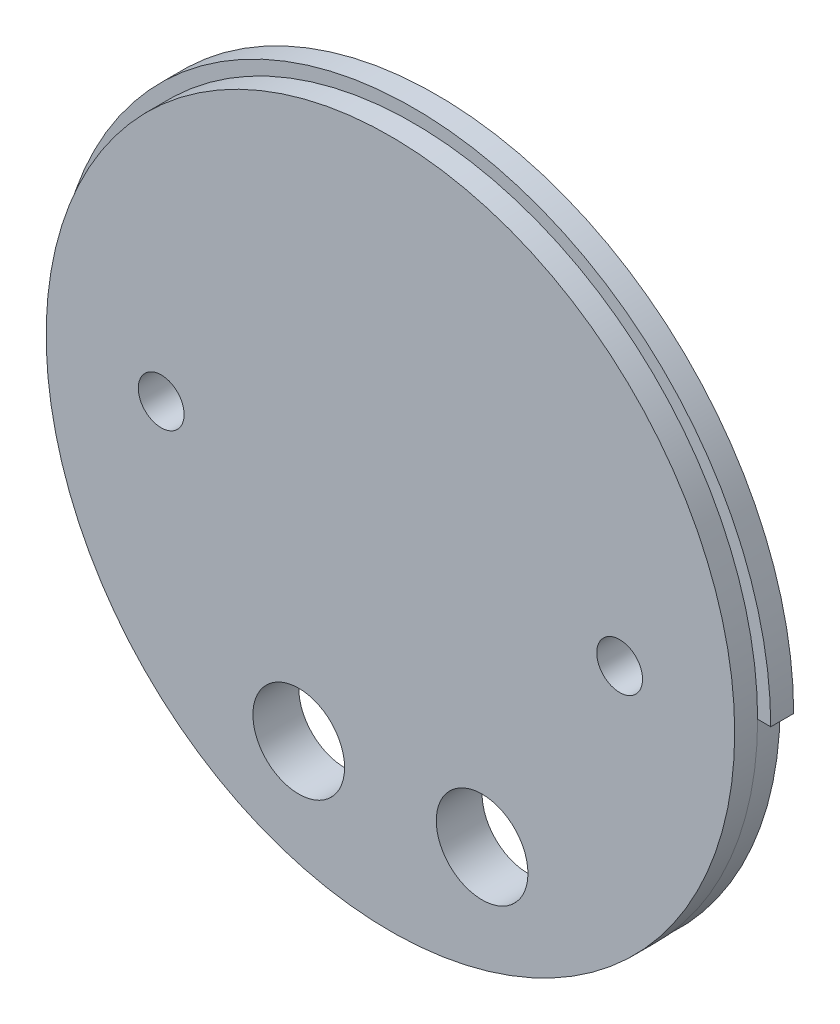
from build123d import *

# Parameters (mm, degrees)
SKETCH1_R           = 49.5046
BOSS_EXTRUDE1_DEPTH = 3.175
SKETCH2_R           = 47.6885
BOSS_EXTRUDE2_DEPTH = 3.175
SKETCH3_R           = 3.175
SKETCH3_R_2         = 6.35
CUT_EXTRUDE1_DEPTH  = 71.297463271
CUT_EXTRUDE2_DEPTH  = 71.082033841


with BuildPart() as part:
    # Sketch1 → Boss-Extrude1 (new body)
    with BuildSketch(Plane.XY):
        Circle(SKETCH1_R)
    extrude(amount=BOSS_EXTRUDE1_DEPTH)

    # Sketch2 → Boss-Extrude2 (add)
    with BuildSketch(Plane.XY.offset(3.175)):
        Circle(SKETCH2_R)
    extrude(amount=BOSS_EXTRUDE2_DEPTH)

    # Sketch3 → Cut-Extrude1 (cut, through all)
    with BuildSketch(Plane.XY.offset(6.35)):
        with Locations((-31.75, 0)):
            Circle(SKETCH3_R)
        with Locations((31.75, 0)):
            Circle(SKETCH3_R)
        with Locations((-12.7, -31.235352443)):
            Circle(SKETCH3_R_2)
        with Locations((12.7, -31.235352443)):
            Circle(SKETCH3_R_2)
    extrude(amount=-CUT_EXTRUDE1_DEPTH, mode=Mode.SUBTRACT)

    # Sketch4 → Cut-Extrude2 (cut, through all)
    with BuildSketch(Plane.XY.offset(3.175)):
        with BuildLine():
            Line((-50.165, 0), (-47.625, 0))
            ThreePointArc((-47.625, 0), (0, -47.625), (47.625, 0))
            Line((47.625, 0), (50.165, 0))
            ThreePointArc((50.165, 0), (0, -50.165), (-50.165, 0))
        make_face()
    extrude(amount=-CUT_EXTRUDE2_DEPTH, mode=Mode.SUBTRACT)


solid = part.part
